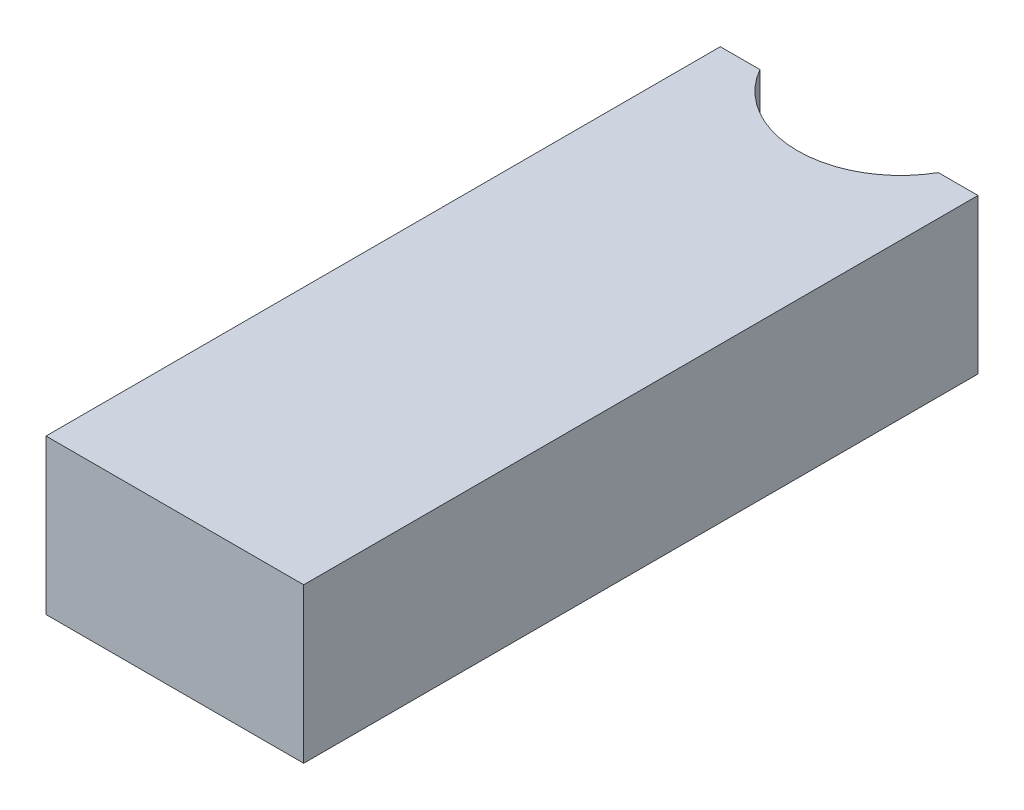
from build123d import *

# Parameters (mm, degrees)
SKETCH1_W           = 31.75
SKETCH1_H           = 19.05
BOSS_EXTRUDE1_DEPTH = 83.0834
SKETCH2_R           = 12.7
CUT_EXTRUDE1_DEPTH  = 87.705071827


with BuildPart() as part:
    # Sketch1 → Boss-Extrude1 (new body)
    with BuildSketch(Plane.XY):
        Rectangle(SKETCH1_W, SKETCH1_H)
    extrude(amount=BOSS_EXTRUDE1_DEPTH)

    # Sketch2 → Cut-Extrude1 (cut, through all)
    with BuildSketch(Plane(origin=(0, 9.525, 0), x_dir=(1, 0, 0), z_dir=(0, 1, 0))):
        with Locations((0, 6.35)):
            Circle(SKETCH2_R)
    extrude(amount=-CUT_EXTRUDE1_DEPTH, mode=Mode.SUBTRACT)


solid = part.part
